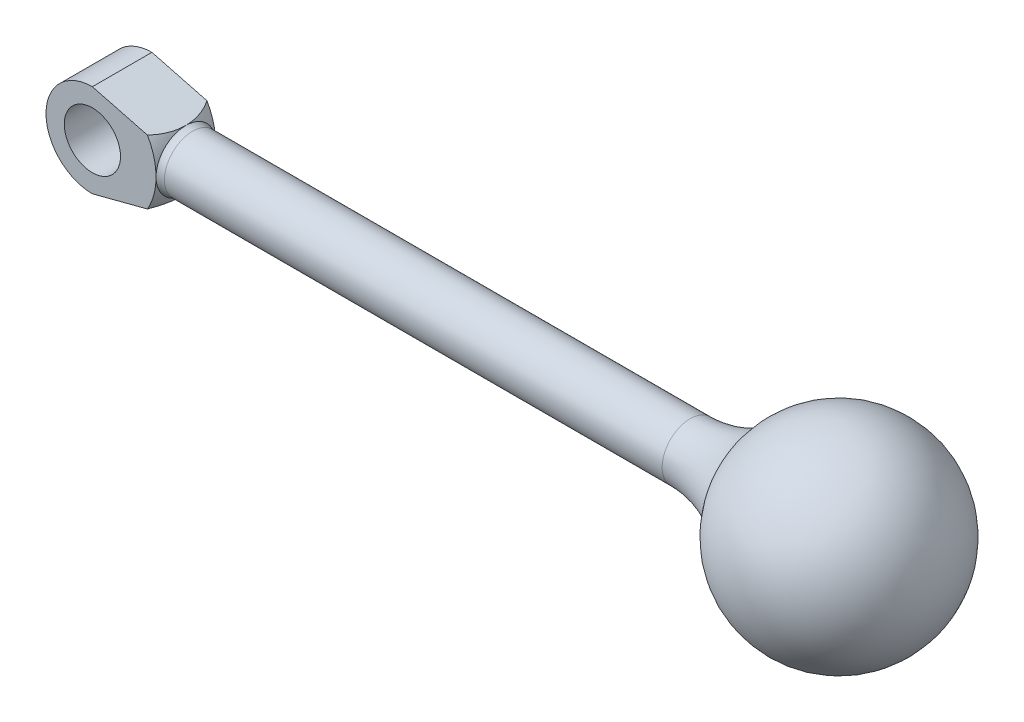
from build123d import *

# Parameters (mm, degrees)
CORTAR_EXTRUIR1_DEPTH      = 10
CORTAR_EXTRUIR1_DEPTH_BACK = 10
CROQUIS3_W                 = 10.64526068670476
CROQUIS3_H                 = 3.3994785725990075
CROQUIS4_R                 = 2.000000000000003
CORTAR_EXTRUIR2_DEPTH      = 10
CORTAR_EXTRUIR3_DEPTH      = 12


with BuildPart() as part:
    # Croquis1 → Revolución1 (revolve)
    with BuildSketch(Plane(origin=(0, 0, 0), x_dir=(1, 0, 0), z_dir=(0, 1, 0))):
        with BuildLine():
            Line((0, 0), (-14, 0))
            ThreePointArc((-14, 0), (-7.000000000000001, -7), (0, 0))
        make_face()
    revolve(axis=Axis((0, 0, 0), (-1, 0, 0)))

    # Croquis2 → Revolución2 (revolve)
    with BuildSketch(Plane(origin=(0, 0, 0), x_dir=(1, 0, 0), z_dir=(0, 1, 0))):
        with BuildLine():
            Line((-14, 0), (-63, -7.72e-15))
            ThreePointArc((-63, -7.72e-15), (-59.08463499046059, -4.880939145028195), (-53.47057322501258, -2.117614953202559))
            ThreePointArc((-53.47057322501258, -2.117614953202559), (-53.239158217402505, -2.028995288641408), (-52.99305737642324, -2.0000000000000018))
            Line((-52.99305737642324, -2.0000000000000018), (-17.584352216063312, -2.0000000000000018))
            ThreePointArc((-17.584352216063312, -2.0000000000000018), (-15.254449379168335, -2.3517694688151263), (-13.132252927177912, -3.3757182994316812))
            Line((-13.132252927177912, -3.3757182994316812), (-14, 0))
        make_face()
    revolve(axis=Axis((0, 0, 0), (-1, 0, 0)))

    # Croquis3 → Cortar-Extruir1 (cut, two sides: drawn at the far end of the back side and taken through both)
    with BuildSketch(Plane(origin=(0, 0, 0), x_dir=(1, 0, 0), z_dir=(0, 1, 0)).offset(-CORTAR_EXTRUIR1_DEPTH_BACK)):
        with Locations((-58.793203568364966, 3.8173542395020648)):
            Rectangle(CROQUIS3_W, CROQUIS3_H)
        Polygon((-53.470573225012586, -5.334174428303361), (-53.470573225012586, -2.1176149532025623), (-64.11583391171735, -2.1176149532025637), (-64.11583391171735, -5.334174428303361), align=None)
    extrude(amount=CORTAR_EXTRUIR1_DEPTH + CORTAR_EXTRUIR1_DEPTH_BACK, mode=Mode.SUBTRACT)

    # Croquis4 → Cortar-Extruir2 (cut)
    with BuildSketch(Plane(origin=(0, 0, -2.117614953202561), x_dir=(-1, 0, 0), z_dir=(0, 0, -1))):
        with Locations((58, 0)):
            Circle(CROQUIS4_R)
    extrude(amount=-CORTAR_EXTRUIR2_DEPTH, mode=Mode.SUBTRACT)

    # Croquis5 → Cortar-Extruir3 (cut)
    with BuildSketch(Plane.XY.offset(2.1176149532025557)):
        with BuildLine():
            Line((-58, -3.2994521483388315), (-53.470573225012586, -2.1176149532025605))
            ThreePointArc((-53.470573225012586, -2.1176149532025605), (-63, -3.83e-15), (-53.470573225012586, 2.117614953202569))
            Line((-53.470573225012586, 2.117614953202569), (-58, 3.2994521483388315))
            ThreePointArc((-58, 3.2994521483388315), (-61.29945214833883, 4e-16), (-58, -3.2994521483388315))
        make_face()
    extrude(amount=-CORTAR_EXTRUIR3_DEPTH, mode=Mode.SUBTRACT)


solid = part.part
